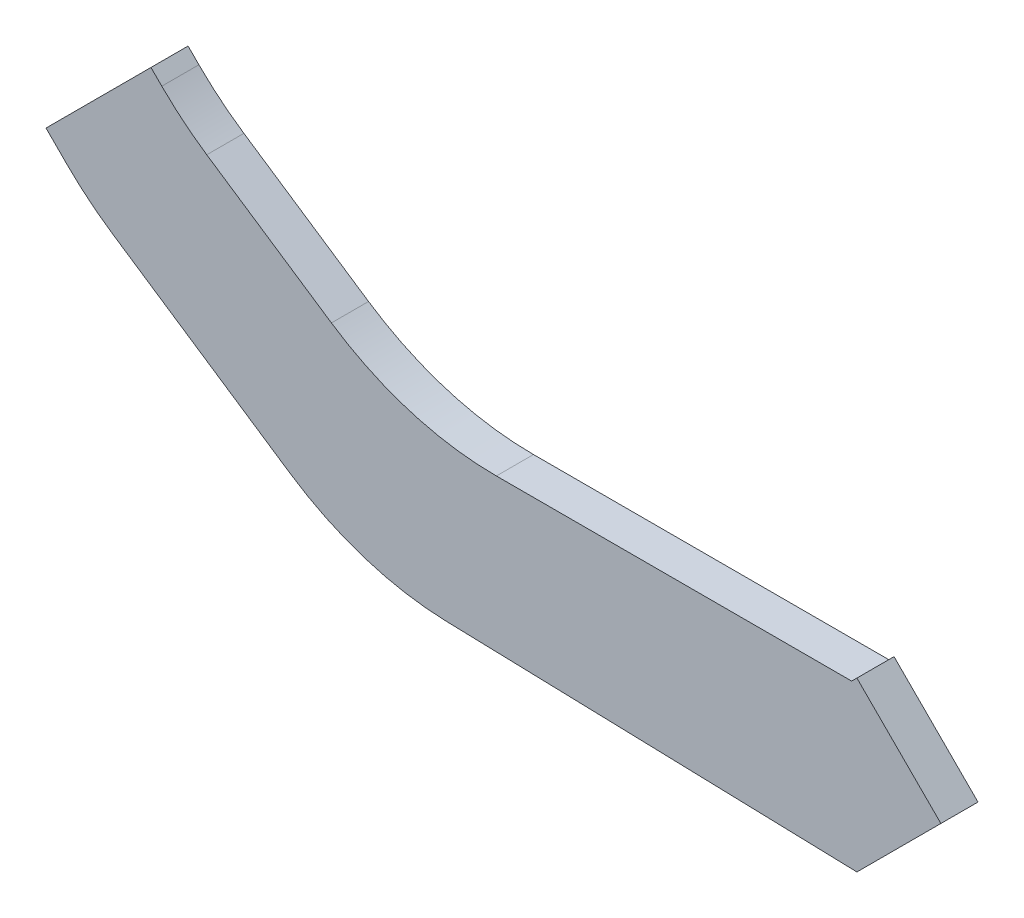
from build123d import *

# Parameters (mm, degrees)
BOSS_EXTRUDE1_DEPTH = 0.125
FILLET1_R           = 2


with BuildPart() as part:
    # frame_outline → Boss-Extrude1 (new, symmetric)
    with BuildSketch(Plane.XY):
        Polygon((-1.803122292, -1.87383297), (-1.590990258, -2.085965005), (-0.083184528, -3.093592168), (2.916815472, -3.093592168), (2.952170811, -3.058236829), (3.517856236, -3.623922254), (2.952170811, -4.189607679), (-0.386567156, -4.093592168), (-2.2284766, -2.862692224), (-2.510229073, -2.580939751), align=None)
    extrude(amount=BOSS_EXTRUDE1_DEPTH, both=True)

    # Fillet1
    fillet1_edges = [part.edges().sort_by_distance(p)[0] for p in [
        (-2.2284766, -2.862692224, 0),
        (-1.590990258, -2.085965005, 0),
        (-0.083184528, -3.093592168, 0),
        (-0.386567156, -4.093592168, 0),
    ]]
    fillet(fillet1_edges, radius=FILLET1_R)


solid = part.part
